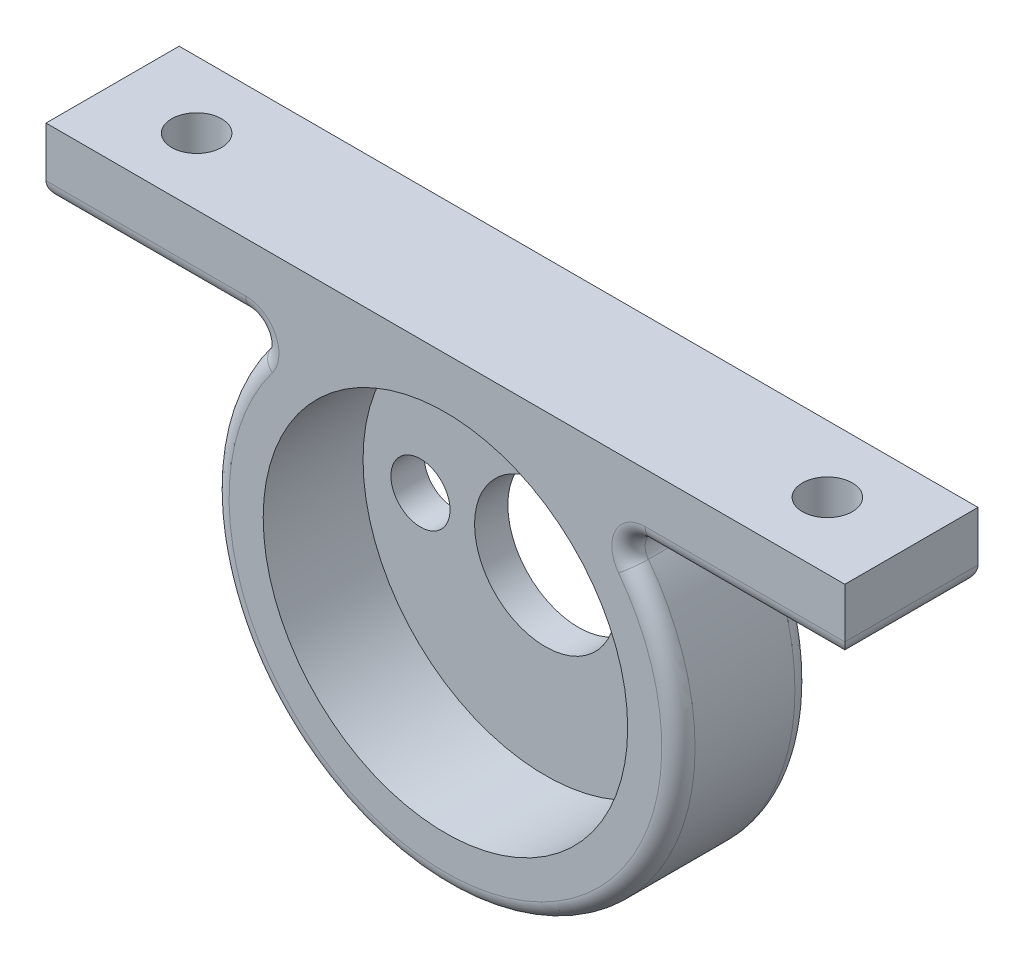
from build123d import *

# Parameters (mm, degrees)
SALIENTE_EXTRUIR1_DEPTH = 8
REDONDEO1_R             = 1
CROQUIS2_R              = 1.5
CORTAR_EXTRUIR1_DEPTH   = 35.871191617
CROQUIS3_R              = 10.95
CORTAR_EXTRUIR2_DEPTH   = 6
CROQUIS4_R              = 4.25
CROQUIS4_R_2            = 1.775
CORTAR_EXTRUIR3_DEPTH   = 29.913664638


with BuildPart() as part:
    # Croquis1 → Saliente-Extruir1 (new body)
    with BuildSketch(Plane.XY):
        with BuildLine():
            Line((0, 14), (24, 14))
            Line((24, 14), (24, 10))
            Line((24, 10), (9.797958971, 10))
            ThreePointArc((9.797958971, 10), (0, -14), (-9.797958971, 10))
            Line((-9.797958971, 10), (-24, 10))
            Line((-24, 10), (-24, 14))
            Line((-24, 14), (0, 14))
        make_face()
    extrude(amount=SALIENTE_EXTRUIR1_DEPTH)

    # Redondeo1
    redondeo1_edges = [part.edges().sort_by_distance(p)[0] for p in [
        (-9.797958971, 10, 4),
        (-24, 10, 4),
        (24, 10, 4),
        (9.797958971, 10, 4),
        (-16.898979486, 10, 8),
        (0, -14, 8),
        (-16.898979486, 10, 0),
        (16.898979486, 10, 8),
        (16.898979486, 10, 0),
        (0, -14, 0),
    ]]
    fillet(redondeo1_edges, radius=REDONDEO1_R)

    # Croquis2 → Cortar-Extruir1 (cut, through all)
    with BuildSketch(Plane.XZ.offset(-10)):
        with Locations(Location((-18.949489743, 4, 0), (0, 0, 270))):
            Circle(CROQUIS2_R)
        with Locations(Location((18.949489743, 4, 0), (0, 0, 270))):
            Circle(CROQUIS2_R)
    extrude(amount=-CORTAR_EXTRUIR1_DEPTH, mode=Mode.SUBTRACT)

    # Croquis3 → Cortar-Extruir2 (cut)
    with BuildSketch(Plane.XY.offset(8)):
        Circle(CROQUIS3_R)
    extrude(amount=-CORTAR_EXTRUIR2_DEPTH, mode=Mode.SUBTRACT)

    # Croquis4 → Cortar-Extruir3 (cut, through all)
    with BuildSketch(Plane(origin=(0, 0, 0), x_dir=(-1, 0, 0), z_dir=(0, 0, -1))):
        Circle(CROQUIS4_R)
        with Locations((7.5, 0)):
            Circle(CROQUIS4_R_2)
        with Locations((-7.5, 0)):
            Circle(CROQUIS4_R_2)
    extrude(amount=-CORTAR_EXTRUIR3_DEPTH, mode=Mode.SUBTRACT)


solid = part.part
